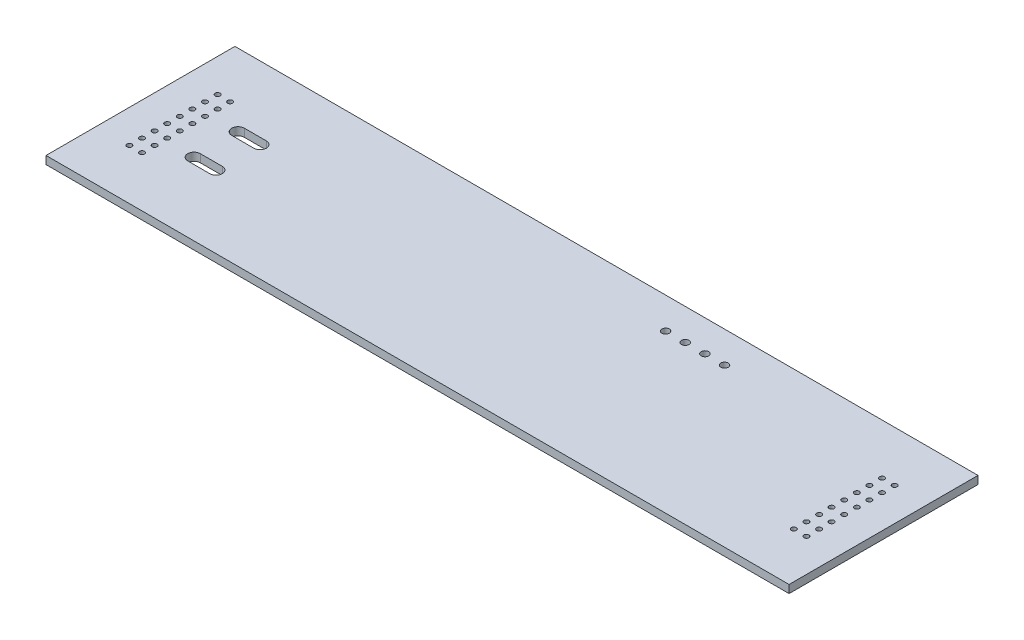
from build123d import *

# Parameters (mm, degrees)
SKETCH1_W             = 149.86
SKETCH1_H             = 38.1
BOSS_EXTRUDE1_DEPTH   = 1.6
F_1_0MM_DOWEL_HOLE1_D = 1
LPATTERN1_COUNT       = 2
LPATTERN1_PITCH       = 2.54
LPATTERN1_COUNT_DIR2  = 8
LPATTERN1_PITCH_DIR2  = 2.54
F_1_5MM_DOWEL_HOLE1_D = 1.5
LPATTERN2_COUNT       = 4
LPATTERN2_PITCH       = 3.96
CUT_EXTRUDE1_DEPTH    = 78.330248933


with BuildPart() as part:
    # Sketch1 → Boss-Extrude1 (new body)
    with BuildSketch(Plane(origin=(0, 27.932895125, 0), x_dir=(1, 0, 0), z_dir=(0, 1, 0))):
        Rectangle(SKETCH1_W, SKETCH1_H)
    extrude(amount=BOSS_EXTRUDE1_DEPTH)

    # Ø1.0mm Dowel Hole1 (through all)
    with Locations(Plane(origin=(65.73, 29.532895125, -8.89), x_dir=(0, 0, 1), z_dir=(0, 1, 0))):
        with Locations((0, 0), (0, -134)):
            f_1_0mm_dowel_hole1 = Hole(F_1_0MM_DOWEL_HOLE1_D / 2)

    # LPattern1: 1.0mm Dowel Hole1 2 × 8
    with Locations(*[(i * LPATTERN1_PITCH, 0, j * LPATTERN1_PITCH_DIR2) for i in range(LPATTERN1_COUNT) for j in range(LPATTERN1_COUNT_DIR2) if (i, j) != (0, 0)]):
        add(f_1_0mm_dowel_hole1, mode=Mode.SUBTRACT)

    # Ø1.5mm Dowel Hole1 (through all)
    with Locations(Plane(origin=(18.23, 29.532895125, -12.75), x_dir=(0, 0, 1), z_dir=(0, 1, 0))):
        with Locations((0, 0)):
            f_1_5mm_dowel_hole1 = Hole(F_1_5MM_DOWEL_HOLE1_D / 2)

    # LPattern2: Ø1.5mm Dowel Hole1 ×4
    with Locations(*[(i * LPATTERN2_PITCH, 0, 0) for i in range(1, LPATTERN2_COUNT)]):
        add(f_1_5mm_dowel_hole1, mode=Mode.SUBTRACT)

    # Sketch6 → Cut-Extrude1 (cut, through all)
    with BuildSketch(Plane(origin=(0, 29.532895125, 0), x_dir=(1, 0, 0), z_dir=(0, 1, 0))):
        with BuildLine():
            Line((-55.245, -5.715), (-59.69, -5.715))
            ThreePointArc((-59.69, -5.715), (-60.96, -4.445), (-59.69, -3.175))
            Line((-59.69, -3.175), (-55.245, -3.175))
            ThreePointArc((-55.245, -3.175), (-53.975, -4.445), (-55.245, -5.715))
        make_face()
        with BuildLine():
            Line((-55.245, 5.715), (-59.69, 5.715))
            ThreePointArc((-59.69, 5.715), (-60.96, 4.445), (-59.69, 3.175))
            Line((-59.69, 3.175), (-55.245, 3.175))
            ThreePointArc((-55.245, 3.175), (-53.975, 4.445), (-55.245, 5.715))
        make_face()
    extrude(amount=-CUT_EXTRUDE1_DEPTH, mode=Mode.SUBTRACT)


solid = part.part
